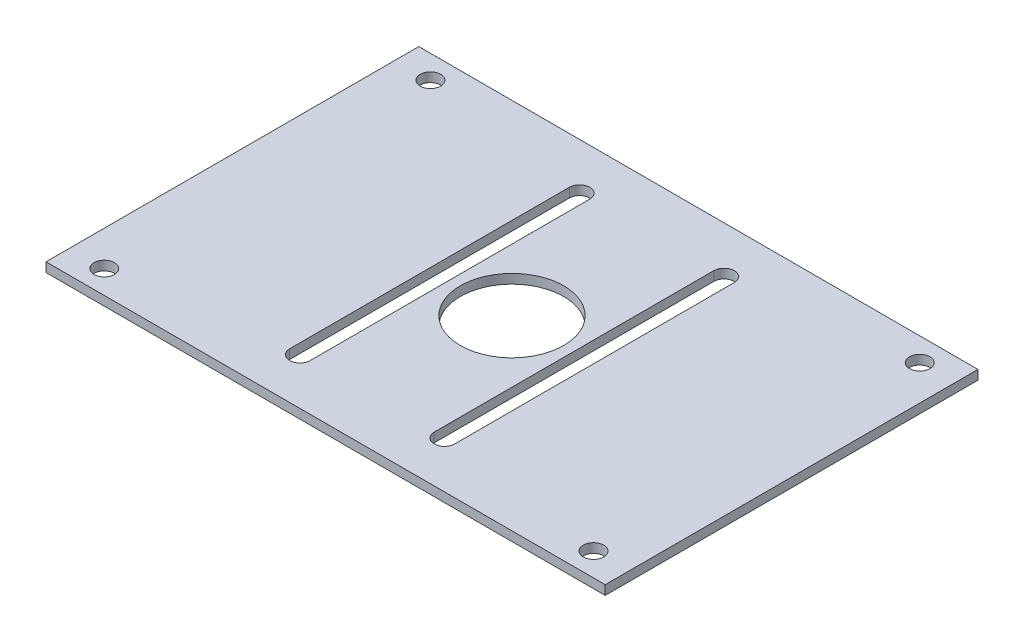
from build123d import *

# Parameters (mm, degrees)
SKETCH1_W           = 120
SKETCH1_H           = 80
SKETCH1_R           = 2.2
SKETCH1_R_2         = 11.1
BOSS_EXTRUDE1_DEPTH = 2


with BuildPart() as part:
    # Sketch1 → Boss-Extrude1 (new body)
    with BuildSketch(Plane(origin=(0, 0, 0), x_dir=(1, 0, 0), z_dir=(0, 1, 0))):
        Rectangle(SKETCH1_W, SKETCH1_H)
        with Locations(Location((-52.5, 35, 0), (0, 0, 270))):
            Circle(SKETCH1_R, mode=Mode.SUBTRACT)
        with Locations(Location((52.5, 35, 0), (0, 0, 90))):
            Circle(SKETCH1_R, mode=Mode.SUBTRACT)
        with Locations(Location((52.5, -35, 0), (0, 0, 270))):
            Circle(SKETCH1_R, mode=Mode.SUBTRACT)
        with Locations(Location((-52.5, -35, 0), (0, 0, 90))):
            Circle(SKETCH1_R, mode=Mode.SUBTRACT)
        with Locations(Location((0, 0, 0), (0, 0, 270))):
            Circle(SKETCH1_R_2, mode=Mode.SUBTRACT)
        with BuildLine():
            Line((-17.7, -30), (-17.7, 30))
            ThreePointArc((-17.7, 30), (-15.5, 32.2), (-13.3, 30))
            Line((-13.3, 30), (-13.3, -30))
            ThreePointArc((-13.3, -30), (-15.5, -32.2), (-17.7, -30))
        make_face(mode=Mode.SUBTRACT)
        with BuildLine():
            Line((13.3, 30), (13.3, -30))
            ThreePointArc((13.3, -30), (15.5, -32.2), (17.7, -30))
            Line((17.7, -30), (17.7, 30))
            ThreePointArc((17.7, 30), (15.5, 32.2), (13.3, 30))
        make_face(mode=Mode.SUBTRACT)
    extrude(amount=BOSS_EXTRUDE1_DEPTH)


solid = part.part
